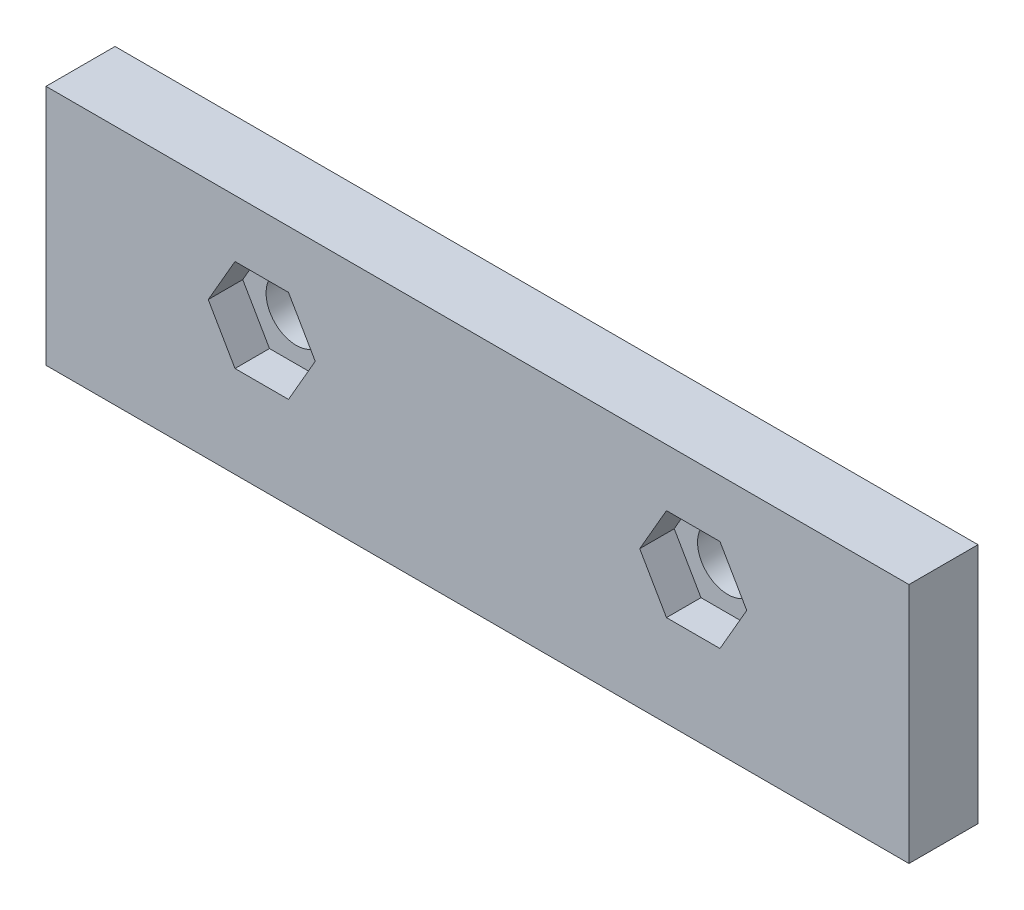
from build123d import *

# Parameters (mm, degrees)
SKETCH1_W                 = 50
SKETCH1_H                 = 14
SKETCH1_R                 = 1.75
BOSS_EXTRUDE1_DEPTH       = 4
NUTHOLECUT_EXTRUDE1_DEPTH = 2


with BuildPart() as part:
    # Sketch1 → Boss-Extrude1 (new body)
    with BuildSketch(Plane.XY):
        with Locations((25, 7)):
            Rectangle(SKETCH1_W, SKETCH1_H)
        with Locations((12.5, 8)):
            Circle(SKETCH1_R, mode=Mode.SUBTRACT)
        with Locations((37.5, 8)):
            Circle(SKETCH1_R, mode=Mode.SUBTRACT)
    extrude(amount=BOSS_EXTRUDE1_DEPTH)

    # NutHoleSketch7 → NutHoleCut-Extrude1 (cut)
    with BuildSketch(Plane.XY.offset(4)):
        Polygon((14.05, 5.315321248), (15.6, 8), (14.05, 10.684678752), (10.95, 10.684678752), (9.4, 8), (10.95, 5.315321248), align=None)
        Polygon((39.05, 5.315321248), (40.6, 8), (39.05, 10.684678752), (35.95, 10.684678752), (34.4, 8), (35.95, 5.315321248), align=None)
    extrude(amount=-NUTHOLECUT_EXTRUDE1_DEPTH, mode=Mode.SUBTRACT)


solid = part.part
